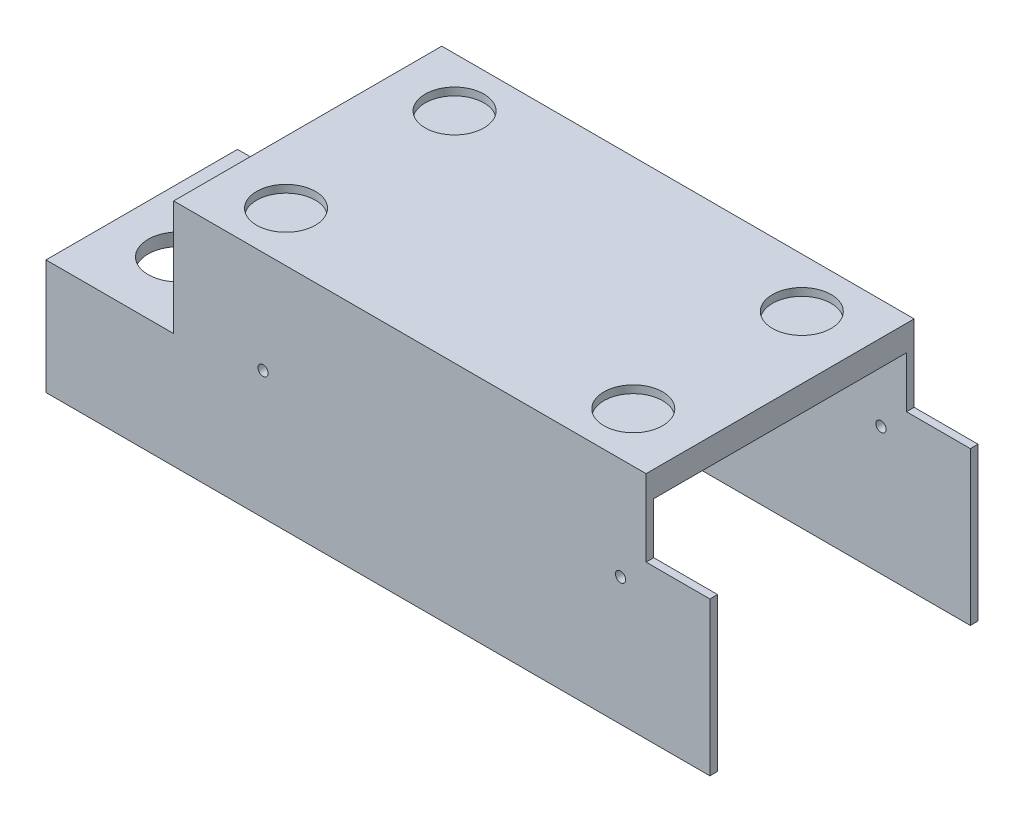
from build123d import *

# Parameters (mm, degrees)
SKETCH_2_W          = 210
SKETCH_2_H          = 105
EXTRUDE_1_DEPTH     = 90
SKETCH_5_W          = 99
SKETCH_5_H          = 80
CUT_EXTRUDE_2_DEPTH = 200
SKETCH_6_W          = 75
SKETCH_6_H          = 45
EXTRUDE_2_DEPTH     = 50
SKETCH_7_W          = 69
SKETCH_7_H          = 40
CUT_EXTRUDE_3_DEPTH = 281.100428418
SKETCH_8_R          = 12
CUT_EXTRUDE_4_DEPTH = 170.724040725
SKETCH_9_R          = 2
CUT_EXTRUDE_5_DEPTH = 208.725780778
SKETCH_11_W         = 25
SKETCH_11_H         = 105
CUT_EXTRUDE_6_DEPTH = 30
SKETCH_4_R          = 11.5
CUT_EXTRUDE_8_DEPTH = 3


with BuildPart() as part:
    # 草图2 → 凸台-拉伸1 (new body)
    with BuildSketch(Plane(origin=(0, 0, 0), x_dir=(1, 0, 0), z_dir=(0, 1, 0))):
        Rectangle(SKETCH_2_W, SKETCH_2_H)
    extrude(amount=EXTRUDE_1_DEPTH)

    # 草图5 → 切除-拉伸2 (cut)
    with BuildSketch(Plane(origin=(105, 0, 0), x_dir=(0, 0, -1), z_dir=(1, 0, 0))):
        with Locations((0, 40)):
            Rectangle(SKETCH_5_W, SKETCH_5_H)
    extrude(amount=-CUT_EXTRUDE_2_DEPTH, mode=Mode.SUBTRACT)

    # 草图6 → 凸台-拉伸2 (add)
    with BuildSketch(Plane.ZY.offset(105)):
        with Locations((15, 22.5)):
            Rectangle(SKETCH_6_W, SKETCH_6_H)
    extrude(amount=EXTRUDE_2_DEPTH)

    # 草图7 → 切除-拉伸3 (cut, through all)
    with BuildSketch(Plane.ZY.offset(155)):
        with Locations((15, 20)):
            Rectangle(SKETCH_7_W, SKETCH_7_H)
    extrude(amount=-CUT_EXTRUDE_3_DEPTH, mode=Mode.SUBTRACT)

    # 草图8 → 切除-拉伸4 (cut, through all)
    with BuildSketch(Plane(origin=(0, 45, 0), x_dir=(1, 0, 0), z_dir=(0, 1, 0))):
        with Locations(Location((-130, -25.5, 0), (0, 0, 270))):
            Circle(SKETCH_8_R)
    extrude(amount=-CUT_EXTRUDE_4_DEPTH, mode=Mode.SUBTRACT)

    # 草图9 → 切除-拉伸5 (cut, through all)
    with BuildSketch(Plane.XY.offset(52.5)):
        with Locations((-70, 50)):
            Circle(SKETCH_9_R)
        with Locations((70, 50)):
            Circle(SKETCH_9_R)
    extrude(amount=-CUT_EXTRUDE_5_DEPTH, mode=Mode.SUBTRACT)

    # 草图11 → 切除-拉伸6 (cut)
    with BuildSketch(Plane(origin=(0, 90, 0), x_dir=(1, 0, 0), z_dir=(0, 1, 0))):
        with Locations((92.5, 0)):
            Rectangle(SKETCH_11_W, SKETCH_11_H)
    extrude(amount=-CUT_EXTRUDE_6_DEPTH, mode=Mode.SUBTRACT)

    # 草图4 → 切除-拉伸8 (cut)
    with BuildSketch(Plane(origin=(0, 90, 0), x_dir=(1, 0, 0), z_dir=(0, 1, 0))):
        with Locations(Location((-80.5, 33, 0), (0, 0, 270))):
            Circle(SKETCH_4_R)
        with Locations(Location((55.5, 33, 0), (0, 0, 270))):
            Circle(SKETCH_4_R)
        with Locations(Location((-80.5, -33, 0), (0, 0, 270))):
            Circle(SKETCH_4_R)
        with Locations(Location((55.5, -33, 0), (0, 0, 270))):
            Circle(SKETCH_4_R)
    extrude(amount=-CUT_EXTRUDE_8_DEPTH, mode=Mode.SUBTRACT)


solid = part.part
